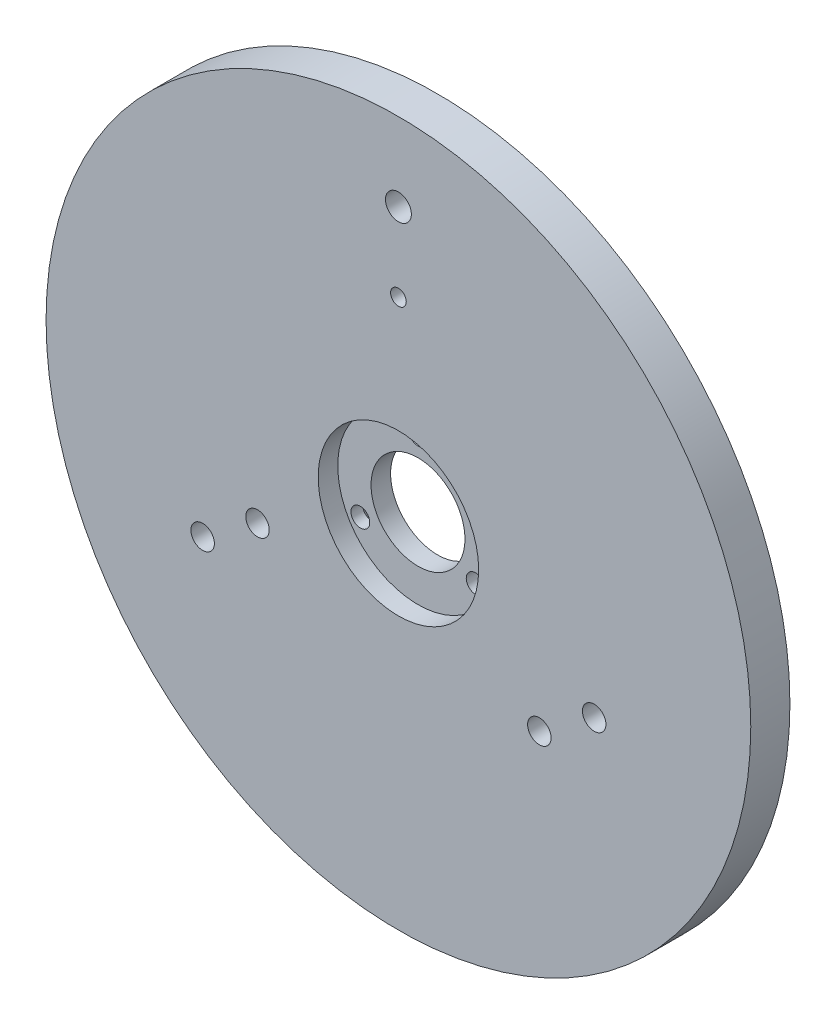
from build123d import *

# Parameters (mm, degrees)
SKETCH1_R                                       = 45
BOSS_EXTRUDE1_DEPTH                             = 5
F_20_5_20_5_DIAMETER_HOLE1_D                    = 20.5
F_20_5_20_5_DIAMETER_HOLE1_DEPTH                = 2.5
F_12_0_12_DIAMETER_HOLE1_D                      = 12
CSK_FOR_M2_FLAT_HEAD_MACHINE_SCREW1_D           = 2.4
CSK_FOR_M2_FLAT_HEAD_MACHINE_SCREW1_DEPTH       = 22.75
CSK_FOR_M2_FLAT_HEAD_MACHINE_SCREW1_CSINK_D     = 4.4
CSK_FOR_M2_FLAT_HEAD_MACHINE_SCREW1_CSINK_ANGLE = 90
CSK_FOR_M2_FLAT_HEAD_MACHINE_SCREW1_TIP         = 0.721032743
M4X0_7_TAPPED_HOLE1_D                           = 3.3
SKETCH15_R                                      = 1.5
M3_TAPPED_HOLE_DEPTH                            = 124.895116934
SKETCH16_R                                      = 1
F_2MM_PIN_DEPTH                                 = 124.895116934


with BuildPart() as part:
    # Sketch1 → Boss-Extrude1 (new body)
    with BuildSketch(Plane.XY.offset(39.5)):
        with Locations((-40, 45)):
            Circle(SKETCH1_R)
    extrude(amount=-BOSS_EXTRUDE1_DEPTH)

    # Ø20.5 (20.5) Diameter Hole1
    with Locations(Plane.XY.offset(39.5)):
        with Locations((-40, 45)):
            Hole(F_20_5_20_5_DIAMETER_HOLE1_D / 2, depth=F_20_5_20_5_DIAMETER_HOLE1_DEPTH)

    # Ø12.0 (12) Diameter Hole1 (through all)
    with Locations(Plane.XY.offset(39.5)):
        with Locations((-40, 45)):
            Hole(F_12_0_12_DIAMETER_HOLE1_D / 2)

    # CSK for M2 Flat Head Machine Screw1
    with Locations(Plane(origin=(0, 0, 34.5), x_dir=(1, 0, 0), z_dir=(0, 0, -1))):
        with Locations((-40, -53.5), (-32.638784068, -40.75), (-47.361215932, -40.75)):
            CounterSinkHole(CSK_FOR_M2_FLAT_HEAD_MACHINE_SCREW1_D / 2, CSK_FOR_M2_FLAT_HEAD_MACHINE_SCREW1_CSINK_D / 2, depth=CSK_FOR_M2_FLAT_HEAD_MACHINE_SCREW1_DEPTH, counter_sink_angle=CSK_FOR_M2_FLAT_HEAD_MACHINE_SCREW1_CSINK_ANGLE)
            with Locations((0, 0, -(CSK_FOR_M2_FLAT_HEAD_MACHINE_SCREW1_DEPTH + CSK_FOR_M2_FLAT_HEAD_MACHINE_SCREW1_TIP / 2))):  # 118° drill point
                Cone(0, CSK_FOR_M2_FLAT_HEAD_MACHINE_SCREW1_D / 2, CSK_FOR_M2_FLAT_HEAD_MACHINE_SCREW1_TIP, mode=Mode.SUBTRACT)

    # M4x0.7 Tapped Hole1 (through all)
    with Locations(Plane.XY.offset(39.5)):
        with Locations((-40, 80)):
            Hole(M4X0_7_TAPPED_HOLE1_D / 2)

    # Sketch15 → M3 Tapped Hole (cut, through all)
    with BuildSketch(Plane.XY.offset(39.5)):
        with Locations((-58, 36)):
            Circle(SKETCH15_R)
        with Locations((-65, 31)):
            Circle(SKETCH15_R)
        with Locations((-15, 36)):
            Circle(SKETCH15_R)
        with Locations((-22, 31)):
            Circle(SKETCH15_R)
    extrude(amount=-M3_TAPPED_HOLE_DEPTH, mode=Mode.SUBTRACT)

    # Sketch16 → 2mm Pin (cut, through all)
    with BuildSketch(Plane.XY.offset(39.5)):
        with Locations((-40, 70)):
            Circle(SKETCH16_R)
    extrude(amount=-F_2MM_PIN_DEPTH, mode=Mode.SUBTRACT)


solid = part.part
